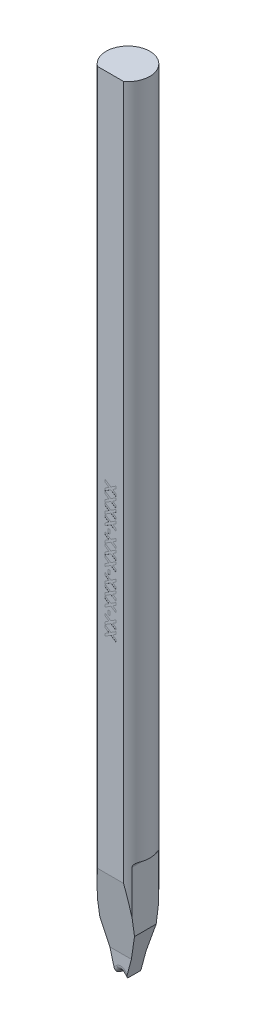
from build123d import *

# Parameters (mm, degrees)
SKETCH_TL_CUTTING_R       = 1.99771
TL_CUTTING_DEPTH          = 72.009
SKETCH_TDF_GRINDING_W     = 4.01542
SKETCH_TDF_GRINDING_H     = 4.01542
TDF_GRINDING_DEPTH        = 73.064400167
SKETCH_ENGRAVING_W        = 0.166666667
SKETCH_ENGRAVING_H        = 0.371794872
ENGRAVING_DEPTH           = 0.005
VW_VR_GRINDING_DEPTH      = 2.00771
VW_VR_GRINDING_DEPTH_BACK = 2.00771
ISA_GRINDING_DEPTH        = 2.00771
ISA_GRINDING_DEPTH_BACK   = 2.00771
PRE_FRX_BRX_DEPTH         = 2.00771
PRE_FRX_BRX_DEPTH_BACK    = 2.00771
SKETCH_PRE_FRX_BRX_W      = 1.33334
SKETCH_PRE_FRX_BRX_H      = 1.80086
FR_EDM_R                  = 0.50038
BR_EDM_R                  = 0.24892
FA_BA_GRINDING_DEPTH      = 2.00771
FA_BA_GRINDING_DEPTH_BACK = 2.00771


with BuildPart() as part:
    # sketch_TL_cutting → TL_cutting (new body)
    with BuildSketch(Plane(origin=(0, 0, 0), x_dir=(1, 0, 0), z_dir=(0, 1, 0))):
        Circle(SKETCH_TL_CUTTING_R)
    extrude(amount=TL_CUTTING_DEPTH)

    # sketch_TDF_grinding → TDF_grinding (cut, through all)
    with BuildSketch(Plane(origin=(0, 0, 0), x_dir=(1, 0, 0), z_dir=(0, 1, 0))):
        with Locations((0, -3.60918)):
            Rectangle(SKETCH_TDF_GRINDING_W, SKETCH_TDF_GRINDING_H)
    extrude(amount=TDF_GRINDING_DEPTH, mode=Mode.SUBTRACT)

    # sketch_engraving → engraving (cut)
    with BuildSketch(Plane.XY.offset(1.60147)):
        Polygon((-0.5, 39.598539744), (0.029647436, 39.255791346), (0.5, 39.560078205), (0.5, 39.33531859), (0.203325321, 39.143411538), (0.5, 38.951504487), (0.5, 38.726744872), (0.029647436, 39.031031731), (-0.5, 38.688283333), (-0.5, 38.913042949), (-0.144030449, 39.143411538), (-0.5, 39.373780128), align=None)
        Polygon((-0.5, 38.675462821), (0.029647436, 38.332714423), (0.5, 38.637001282), (0.5, 38.412241667), (0.203325321, 38.220334615), (0.5, 38.028427564), (0.5, 37.803667949), (0.029647436, 38.107954808), (-0.5, 37.76520641), (-0.5, 37.989966026), (-0.144030449, 38.220334615), (-0.5, 38.450703205), align=None)
        Polygon((-0.5, 37.752385897), (0.029647436, 37.4096375), (0.5, 37.713924359), (0.5, 37.489164744), (0.203325321, 37.297257692), (0.5, 37.105350641), (0.5, 36.880591026), (0.029647436, 37.184877885), (-0.5, 36.842129487), (-0.5, 37.066889103), (-0.144030449, 37.297257692), (-0.5, 37.527626282), align=None)
        Polygon((-0.5, 36.829308974), (0.029647436, 36.486560577), (0.5, 36.790847436), (0.5, 36.566087821), (0.203325321, 36.374180769), (0.5, 36.182273718), (0.5, 35.957514103), (0.029647436, 36.261800962), (-0.5, 35.919052564), (-0.5, 36.143812179), (-0.144030449, 36.374180769), (-0.5, 36.604549359), align=None)
        with Locations((-0.147435898, 35.649821795)):
            Rectangle(SKETCH_ENGRAVING_W, SKETCH_ENGRAVING_H)
        Polygon((-0.5, 35.44469359), (0.029647436, 35.101945192), (0.5, 35.406232051), (0.5, 35.181472436), (0.203325321, 34.989565385), (0.5, 34.797658333), (0.5, 34.572898718), (0.029647436, 34.877185577), (-0.5, 34.534437179), (-0.5, 34.759196795), (-0.144030449, 34.989565385), (-0.5, 35.219933974), align=None)
        Polygon((-0.5, 34.521616667), (0.029647436, 34.178868269), (0.5, 34.483155128), (0.5, 34.258395513), (0.203325321, 34.066488462), (0.5, 33.87458141), (0.5, 33.649821795), (0.029647436, 33.954108654), (-0.5, 33.611360256), (-0.5, 33.836119872), (-0.144030449, 34.066488462), (-0.5, 34.296857051), align=None)
        Polygon((-0.5, 33.598539744), (0.029647436, 33.255791346), (0.5, 33.560078205), (0.5, 33.33531859), (0.203325321, 33.143411538), (0.5, 32.951504487), (0.5, 32.726744872), (0.029647436, 33.031031731), (-0.5, 32.688283333), (-0.5, 32.913042949), (-0.144030449, 33.143411538), (-0.5, 33.373780128), align=None)
        with Locations((-0.147435898, 32.419052564)):
            Rectangle(SKETCH_ENGRAVING_W, SKETCH_ENGRAVING_H)
        Polygon((-0.5, 32.213924359), (0.029647436, 31.871175962), (0.5, 32.175462821), (0.5, 31.950703205), (0.203325321, 31.758796154), (0.5, 31.566889103), (0.5, 31.342129487), (0.029647436, 31.646416346), (-0.5, 31.303667949), (-0.5, 31.528427564), (-0.144030449, 31.758796154), (-0.5, 31.989164744), align=None)
        Polygon((-0.5, 31.290847436), (0.029647436, 30.948099038), (0.5, 31.252385897), (0.5, 31.027626282), (0.203325321, 30.835719231), (0.5, 30.643812179), (0.5, 30.419052564), (0.029647436, 30.723339423), (-0.5, 30.380591026), (-0.5, 30.605350641), (-0.144030449, 30.835719231), (-0.5, 31.066087821), align=None)
        Polygon((-0.5, 30.367770513), (0.029647436, 30.025022115), (0.5, 30.329308974), (0.5, 30.104549359), (0.203325321, 29.912642308), (0.5, 29.720735256), (0.5, 29.495975641), (0.029647436, 29.8002625), (-0.5, 29.457514103), (-0.5, 29.682273718), (-0.144030449, 29.912642308), (-0.5, 30.143010897), align=None)
        with Locations((-0.147435898, 29.188283333)):
            Rectangle(SKETCH_ENGRAVING_W, SKETCH_ENGRAVING_H)
        Polygon((-0.5, 28.983155128), (0.029647436, 28.640406731), (0.5, 28.94469359), (0.5, 28.719933974), (0.203325321, 28.528026923), (0.5, 28.336119872), (0.5, 28.111360256), (0.029647436, 28.415647115), (-0.5, 28.072898718), (-0.5, 28.297658333), (-0.144030449, 28.528026923), (-0.5, 28.758395513), align=None)
        Polygon((-0.5, 28.060078205), (0.029647436, 27.717329808), (0.5, 28.021616667), (0.5, 27.796857051), (0.203325321, 27.60495), (0.5, 27.413042949), (0.5, 27.188283333), (0.029647436, 27.492570192), (-0.5, 27.149821795), (-0.5, 27.37458141), (-0.144030449, 27.60495), (-0.5, 27.83531859), align=None)
    extrude(amount=-ENGRAVING_DEPTH, mode=Mode.SUBTRACT)

    # sketch_VW_VR_grinding → VW_VR_grinding (cut, two sides: drawn at the far end of the back side and taken through both)
    with BuildSketch(Plane.XY.offset(-VW_VR_GRINDING_DEPTH_BACK)):
        with BuildLine():
            Line((-1.59004, -0.01), (-1.59004, 9.681972))
            ThreePointArc((-1.59004, 9.681972), (-1.683182387, 9.906837613), (-1.908048, 9.99998))
            Line((-1.908048, 9.99998), (-2.00771, 9.99998))
            Line((-2.00771, 9.99998), (-2.00771, -0.01))
            Line((-2.00771, -0.01), (-1.59004, -0.01))
        make_face()
        with BuildLine():
            Line((1.59004, -0.01), (1.59004, 9.681972))
            ThreePointArc((1.59004, 9.681972), (1.683182387, 9.906837613), (1.908048, 9.99998))
            Line((1.908048, 9.99998), (2.00771, 9.99998))
            Line((2.00771, 9.99998), (2.00771, -0.01))
            Line((2.00771, -0.01), (1.59004, -0.01))
        make_face()
    extrude(amount=VW_VR_GRINDING_DEPTH + VW_VR_GRINDING_DEPTH_BACK, mode=Mode.SUBTRACT)

    # sketch_ISA_grinding → ISA_grinding (cut, two sides: drawn at the far end of the back side and taken through both)
    with BuildSketch(Plane.XY.offset(-ISA_GRINDING_DEPTH_BACK)):
        Polygon((-0.50038, 0), (-2.00771, 5.625432144), (-2.00771, -0.01), (2.00771, -0.01), (2.00771, 5.625432144), (0.50038, 0), align=None)
    extrude(amount=ISA_GRINDING_DEPTH + ISA_GRINDING_DEPTH_BACK, mode=Mode.SUBTRACT)

    # sketch_pre_FRX_BRX → pre_FRX_BRX (cut, two sides: drawn at the far end of the back side and taken through both)
    with BuildSketch(Plane(origin=(0, 0, 0), x_dir=(0, 0, -1), z_dir=(1, 0, 0)).offset(-PRE_FRX_BRX_DEPTH_BACK)):
        with Locations((-1.34104, 0.89043)):
            Rectangle(SKETCH_PRE_FRX_BRX_W, SKETCH_PRE_FRX_BRX_H)
        with Locations((1.34104, 0.89043)):
            Rectangle(SKETCH_PRE_FRX_BRX_W, SKETCH_PRE_FRX_BRX_H)
    extrude(amount=PRE_FRX_BRX_DEPTH + PRE_FRX_BRX_DEPTH_BACK, mode=Mode.SUBTRACT)

    # V-Groove_EDM: sweep along a path in sketch_contour_V-Groove
    with BuildLine(Plane(origin=(0, 0, 0), x_dir=(0, 0, -1), z_dir=(1, 0, 0))) as v_groove_edm_path:
        Line((-1.60147, 0.28448), (0, 0.28448))
        Line((0, 0.28448), (1.99771, 0.28448))
    # sketch_section_V-Groove → V-Groove_EDM (sweep, cut)
    with BuildSketch(Plane.XY.offset(1.60147)):
        with BuildLine():
            Line((-3.1496, -2.8448), (-0.03468841, 0.27011159))
            ThreePointArc((-0.03468841, 0.27011159), (0, 0.28448), (0.03468841, 0.27011159))
            Line((0.03468841, 0.27011159), (3.1496, -2.8448))
            Line((3.1496, -2.8448), (-3.1496, -2.8448))
        make_face()
    sweep(path=v_groove_edm_path.line, mode=Mode.SUBTRACT)

    # FR_EDM
    fr_edm_edges = [part.edges().sort_by_distance(p)[0] for p in [
        (0.169744205, 0.135055795, 0.67437),
        (0, 0.28448, 0.67437),
        (-0.169744205, 0.135055795, 0.67437),
    ]]
    fillet(fr_edm_edges, radius=FR_EDM_R)

    # BR_EDM
    br_edm_edges = [part.edges().sort_by_distance(p)[0] for p in [
        (0.169744205, 0.135055795, -0.67437),
        (0, 0.28448, -0.67437),
        (-0.169744205, 0.135055795, -0.67437),
    ]]
    fillet(br_edm_edges, radius=BR_EDM_R)

    # sketch_FA_BA_grinding → FA_BA_grinding (cut, two sides: drawn at the far end of the back side and taken through both)
    with BuildSketch(Plane(origin=(0, 0, 0), x_dir=(0, 0, -1), z_dir=(1, 0, 0)).offset(-FA_BA_GRINDING_DEPTH_BACK)):
        Polygon((2.99771, 18.332283091), (2.99771, -0.1), (0.67437, -0.1), (0.67437, 1.80086), align=None)
        Polygon((-3.622078656, 22.774896919), (-0.67437, 1.80086), (-0.67437, -0.1), (-3.622078656, -0.1), align=None)
    extrude(amount=FA_BA_GRINDING_DEPTH + FA_BA_GRINDING_DEPTH_BACK, mode=Mode.SUBTRACT)


solid = part.part
